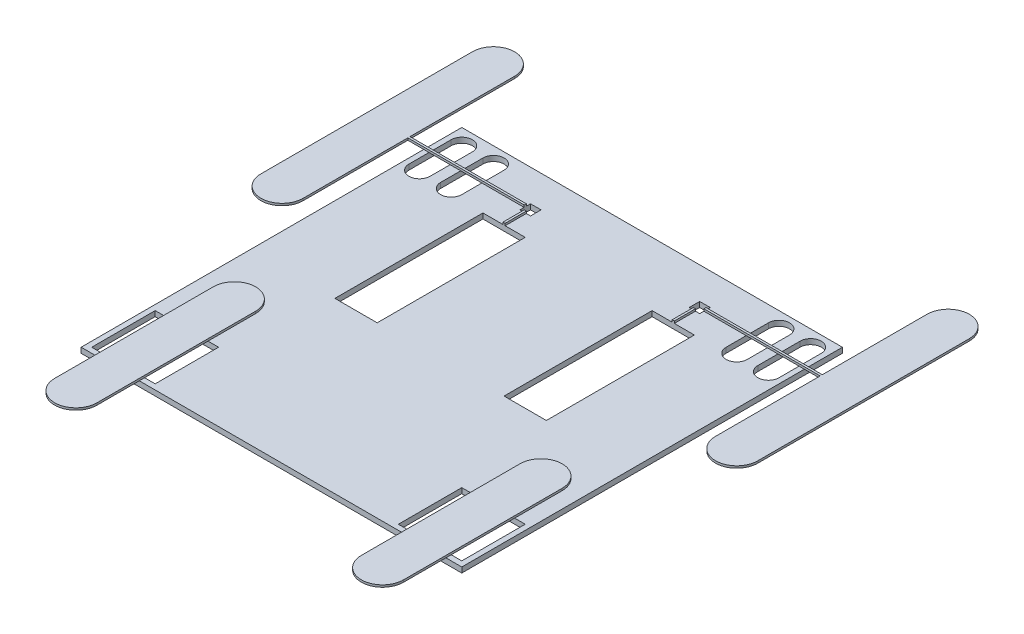
from build123d import *

# Parameters (mm, degrees)
SKETCH2_W           = 457.2
SKETCH2_H           = 457.2
SKETCH2_W_2         = 12.7
SKETCH2_H_2         = 12.7
SKETCH2_W_3         = 50.8
SKETCH2_H_3         = 177.8
SKETCH2_W_4         = 76.2
SKETCH2_H_4         = 76.2
BOSS_EXTRUDE1_DEPTH = 6.35
SKETCH3_W           = 2.54
SKETCH3_H           = 25.4
BOSS_EXTRUDE2_DEPTH = 2.54


with BuildPart() as part:
    # Sketch2 → Boss-Extrude1 (new body)
    with BuildSketch(Plane(origin=(0, 0, 0), x_dir=(1, 0, 0), z_dir=(0, 1, 0))):
        with Locations((228.6, 228.6)):
            Rectangle(SKETCH2_W, SKETCH2_H)
        with BuildLine():
            Line((31.75, 438.15), (31.75, 387.35))
            ThreePointArc((31.75, 387.35), (19.05, 374.65), (6.35, 387.35))
            Line((6.35, 387.35), (6.35, 438.15))
            ThreePointArc((6.35, 438.15), (19.05, 450.85), (31.75, 438.15))
        make_face(mode=Mode.SUBTRACT)
        with BuildLine():
            Line((69.85, 438.15), (69.85, 387.35))
            ThreePointArc((69.85, 387.35), (57.15, 374.65), (44.45, 387.35))
            Line((44.45, 387.35), (44.45, 438.15))
            ThreePointArc((44.45, 438.15), (57.15, 450.85), (69.85, 438.15))
        make_face(mode=Mode.SUBTRACT)
        with BuildLine():
            Line((425.45, 438.15), (425.45, 387.35))
            ThreePointArc((425.45, 387.35), (438.15, 374.65), (450.85, 387.35))
            Line((450.85, 387.35), (450.85, 438.15))
            ThreePointArc((450.85, 438.15), (438.15, 450.85), (425.45, 438.15))
        make_face(mode=Mode.SUBTRACT)
        with BuildLine():
            Line((387.35, 438.15), (387.35, 387.35))
            ThreePointArc((387.35, 387.35), (400.05, 374.65), (412.75, 387.35))
            Line((412.75, 387.35), (412.75, 438.15))
            ThreePointArc((412.75, 438.15), (400.05, 450.85), (387.35, 438.15))
        make_face(mode=Mode.SUBTRACT)
        with Locations((330.2, 412.75)):
            Rectangle(SKETCH2_W_2, SKETCH2_H_2, mode=Mode.SUBTRACT)
        with Locations((127, 292.1)):
            Rectangle(SKETCH2_W_3, SKETCH2_H_3, mode=Mode.SUBTRACT)
        with Locations((127, 412.75)):
            Rectangle(SKETCH2_W_2, SKETCH2_H_2, mode=Mode.SUBTRACT)
        with Locations((330.2, 292.1)):
            Rectangle(SKETCH2_W_3, SKETCH2_H_3, mode=Mode.SUBTRACT)
        with Locations((412.75, 44.45)):
            Rectangle(SKETCH2_W_4, SKETCH2_H_4, mode=Mode.SUBTRACT)
        with Locations((44.45, 44.45)):
            Rectangle(SKETCH2_W_4, SKETCH2_H_4, mode=Mode.SUBTRACT)
    extrude(amount=BOSS_EXTRUDE1_DEPTH)

    # Sketch3 → Boss-Extrude2 (add)
    with BuildSketch(Plane(origin=(0, 6.35, 0), x_dir=(1, 0, 0), z_dir=(0, 1, 0))):
        with BuildLine():
            Line((120.65, 411.48), (-19.05, 411.48))
            Line((-19.05, 411.48), (-19.05, 285.75))
            ThreePointArc((-19.05, 285.75), (-44.45, 260.35), (-69.85, 285.75))
            Line((-69.85, 285.75), (-69.85, 539.75))
            ThreePointArc((-69.85, 539.75), (-44.45, 565.15), (-19.05, 539.75))
            Line((-19.05, 539.75), (-19.05, 414.02))
            Line((-19.05, 414.02), (120.65, 414.02))
            Line((120.65, 414.02), (120.65, 411.48))
        make_face()
        with Locations((127, 393.7)):
            Rectangle(SKETCH3_W, SKETCH3_H)
        with Locations((330.2, 393.7)):
            Rectangle(SKETCH3_W, SKETCH3_H)
        with BuildLine():
            Line((336.55, 411.48), (336.55, 414.02))
            Line((336.55, 414.02), (476.25, 414.02))
            Line((476.25, 414.02), (476.25, 539.75))
            ThreePointArc((476.25, 539.75), (501.65, 565.15), (527.05, 539.75))
            Line((527.05, 539.75), (527.05, 285.75))
            ThreePointArc((527.05, 285.75), (501.65, 260.35), (476.25, 285.75))
            Line((476.25, 285.75), (476.25, 411.48))
            Line((476.25, 411.48), (336.55, 411.48))
        make_face()
        with BuildLine():
            Line((69.85, 139.7), (69.85, -50.8))
            ThreePointArc((69.85, -50.8), (44.45, -76.2), (19.05, -50.8))
            Line((19.05, -50.8), (19.05, 139.7))
            ThreePointArc((19.05, 139.7), (44.45, 165.1), (69.85, 139.7))
        make_face()
        with BuildLine():
            Line((387.35, 139.7), (387.35, -50.8))
            ThreePointArc((387.35, -50.8), (412.75, -76.2), (438.15, -50.8))
            Line((438.15, -50.8), (438.15, 139.7))
            ThreePointArc((438.15, 139.7), (412.75, 165.1), (387.35, 139.7))
        make_face()
    extrude(amount=BOSS_EXTRUDE2_DEPTH)


solid = part.part
